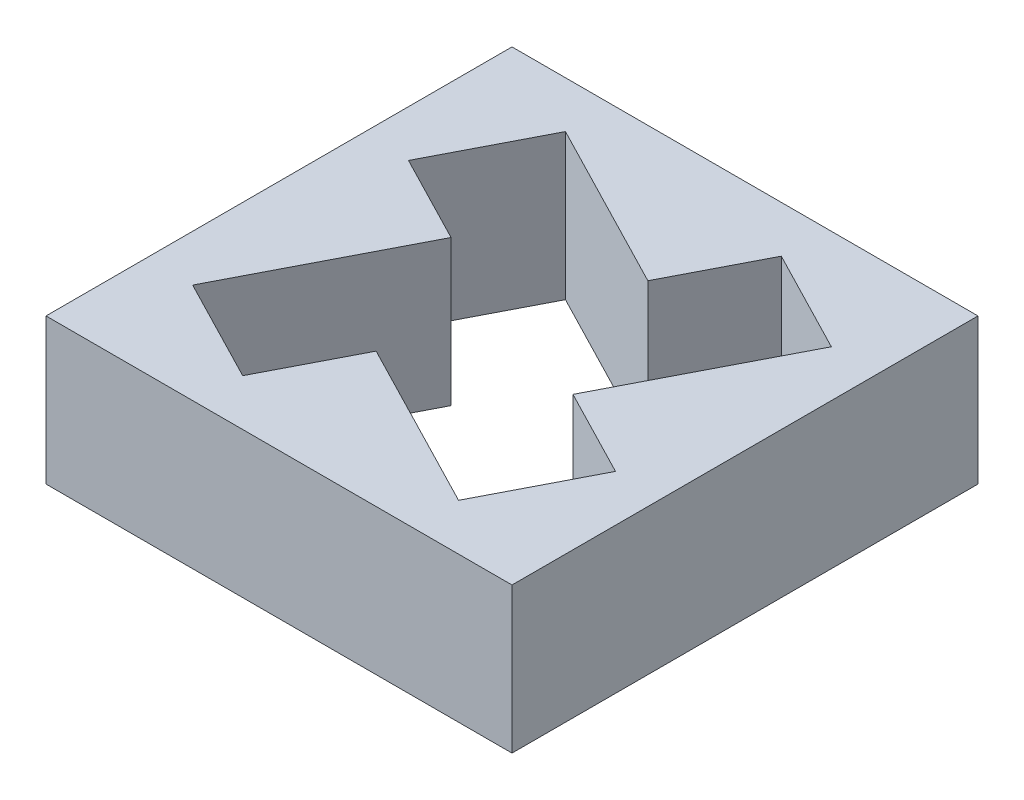
from build123d import *

# Parameters (mm, degrees)
SKETCH1_W           = 80
SKETCH1_H           = 80
BOSS_EXTRUDE1_DEPTH = 25
CUT_EXTRUDE1_DEPTH  = 116.866302263


with BuildPart() as part:
    # Sketch1 → Boss-Extrude1 (new body)
    with BuildSketch(Plane(origin=(0, 0, 0), x_dir=(1, 0, 0), z_dir=(0, 1, 0))):
        with Locations((40, 40)):
            Rectangle(SKETCH1_W, SKETCH1_H)
    extrude(amount=BOSS_EXTRUDE1_DEPTH)

    # Sketch2 → Cut-Extrude1 (cut, through all)
    with BuildSketch(Plane(origin=(0, 25, 0), x_dir=(1, 0, 0), z_dir=(0, 1, 0))):
        Polygon((46.429611169, 56.894824113), (17.175992553, 72), (8, 54.229204839), (23.105175887, 46.429611169), (8, 17.175992553), (25.770795161, 8), (33.570388831, 23.105175887), (62.824007447, 8), (72, 25.770795161), (56.894824113, 33.570388831), (72, 62.824007447), (54.229204839, 72), align=None)
    extrude(amount=-CUT_EXTRUDE1_DEPTH, mode=Mode.SUBTRACT)


solid = part.part
